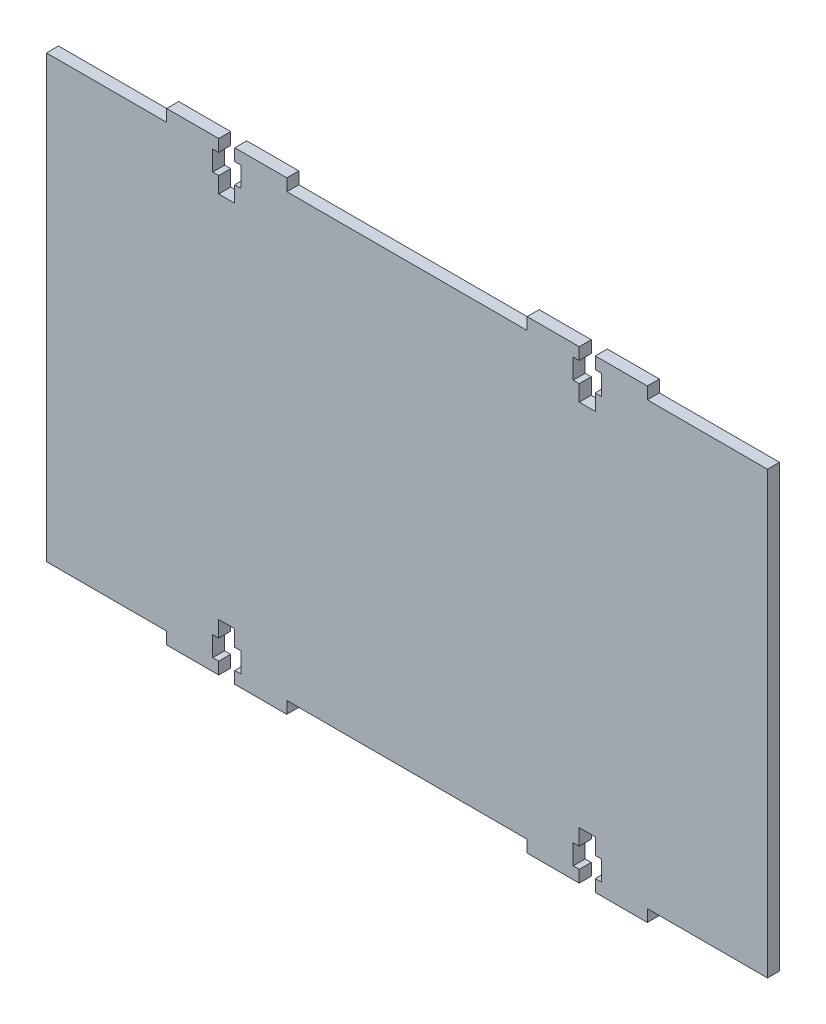
from build123d import *

# Parameters (mm, degrees)
EXTRUDE_1_DEPTH = 3


with BuildPart() as part:
    # 草图1 → 凸台-拉伸1 (new body)
    with BuildSketch(Plane.XY):
        Polygon((90, -55), (90, 0), (60, 0), (48.5, 0), (48.5, -5), (47, -5), (47, -9), (43, -9), (43, -5), (41.5, -5), (41.5, 0), (30, 0), (0, 0), (0, -55), align=None)
        Polygon((120, 0), (90, 0), (90, -55), (180, -55), (180, 0), (150, 0), (138.5, 0), (138.5, -5), (137, -5), (137, -9), (133, -9), (133, -5), (131.5, -5), (131.5, 0), align=None)
        Polygon((180, -55), (90, -55), (90, -110), (120, -110), (131.5, -110), (131.5, -105), (133, -105), (133, -101), (137, -101), (137, -105), (138.5, -105), (138.5, -110), (150, -110), (180, -110), align=None)
        Polygon((90, -110), (90, -55), (0, -55), (0, -110), (30, -110), (41.5, -110), (41.5, -105), (43, -105), (43, -101), (47, -101), (47, -105), (48.5, -105), (48.5, -110), (60, -110), align=None)
        Polygon((120, 3), (120, 0), (131.5, 0), (133, 0), (133, 3), align=None)
        Polygon((138.5, 0), (150, 0), (150, 3), (137, 3), (137, 0), align=None)
        Polygon((30, 3), (30, 0), (41.5, 0), (43, 0), (43, 3), align=None)
        Polygon((48.5, 0), (60, 0), (60, 3), (47, 3), (47, 0), align=None)
        Polygon((60, -113), (60, -110), (48.5, -110), (47, -110), (47, -113), align=None)
        Polygon((41.5, -110), (30, -110), (30, -113), (43, -113), (43, -110), align=None)
        Polygon((150, -113), (150, -110), (138.5, -110), (137, -110), (137, -113), align=None)
        Polygon((131.5, -110), (120, -110), (120, -113), (133, -113), (133, -110), align=None)
    extrude(amount=EXTRUDE_1_DEPTH)


solid = part.part
